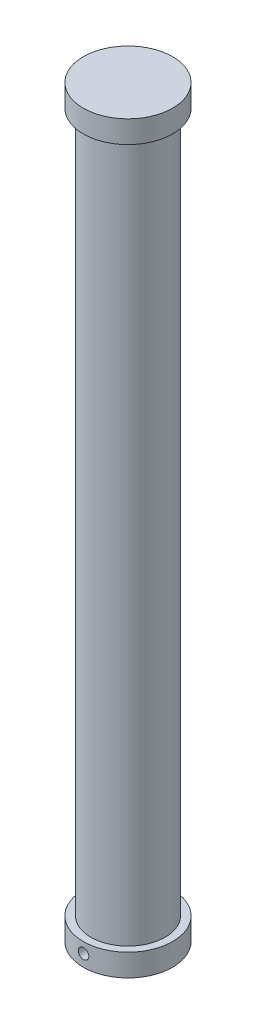
from build123d import *

# Parameters (mm, degrees)
SKETCH2_R          = 0.35
CUT_EXTRUDE1_DEPTH = 5


with BuildPart() as part:
    # Sketch1 → Revolve1 (revolve)
    with BuildSketch(Plane.XY, mode=Mode.PRIVATE) as revolve1_sk:
        Polygon((0, 0), (3, 0), (3, 1.5), (2.5, 1.5), (2.5, 48.5), (3, 48.5), (3, 50), (0, 50), align=None)
    revolve(revolve1_sk.sketch.rotate(Axis((0, 50, 0), (0, -1, 0)), 180), axis=Axis((0, 50, 0), (0, -1, 0)))

    # Sketch2 → Cut-Extrude1 (cut, symmetric)
    with BuildSketch(Plane.XY):
        with Locations(Location((0, 0.802923523, 0), (0, 0, 180))):
            Circle(SKETCH2_R)
    extrude(amount=CUT_EXTRUDE1_DEPTH, both=True, mode=Mode.SUBTRACT)


solid = part.part
